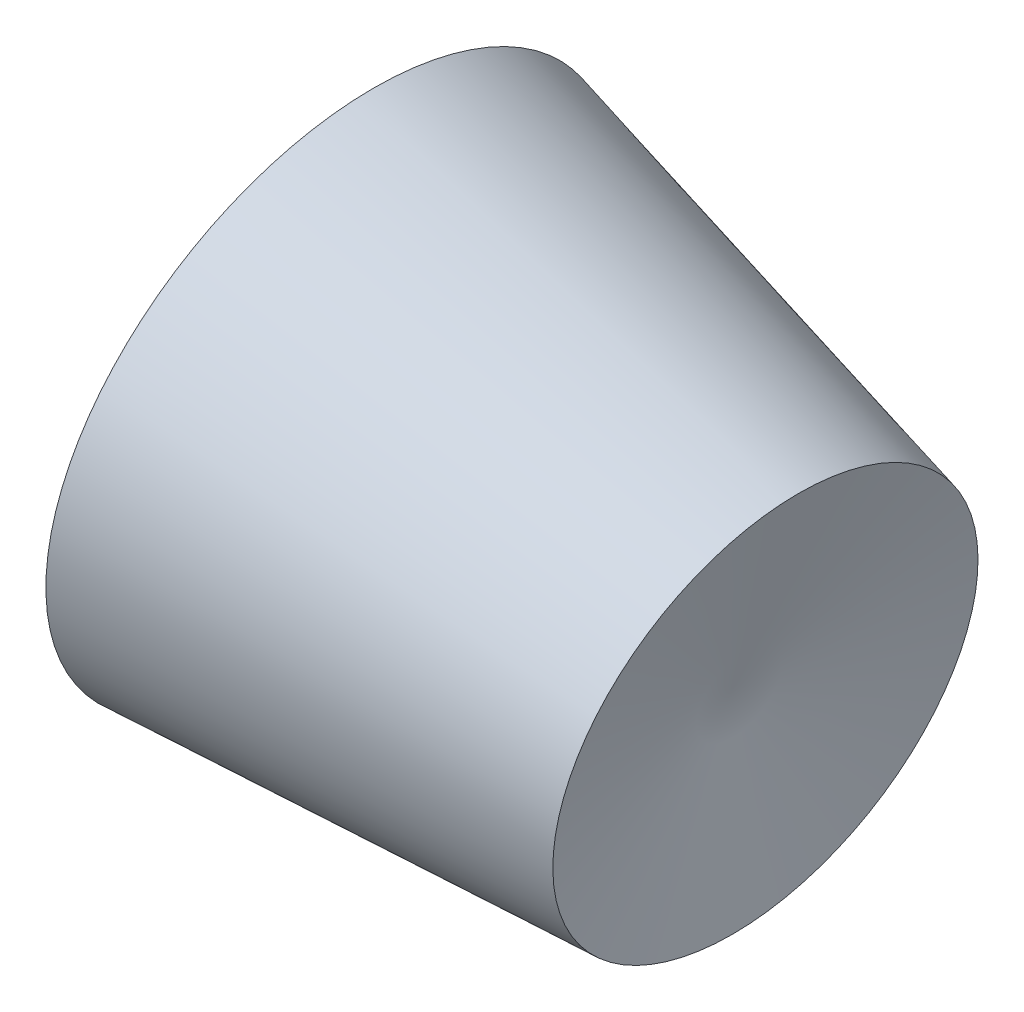
from build123d import *


with BuildPart() as part:
    # Sketch1 → Revolve2 (revolve)
    with BuildSketch(Plane.XY):
        Polygon((-60.699183197, -21.000833472), (-60.699183197, 61.647607935), (40.917752959, 74.925554259), (124.379129855, 61.647607935), (124.379129855, -26.420403401), (-60.699183197, -26.420403401), align=None)
    revolve(axis=Axis((40.917752959, 74.925554259, 0), (0.9875803063351138, -0.15711504873513185, 0)))


solid = part.part
